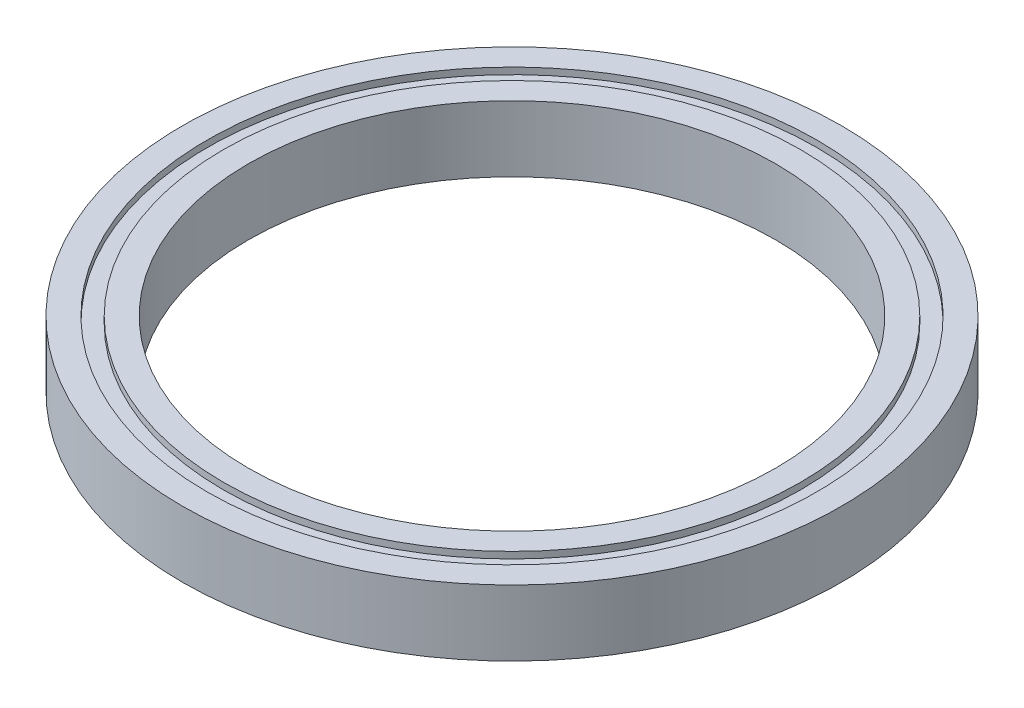
from build123d import *

# Parameters (mm, degrees)
SKETCH1_R           = 50
SKETCH1_R_2         = 40
BOSS_EXTRUDE1_DEPTH = 10
SKETCH2_R           = 46.25
SKETCH2_R_2         = 43.75
CUT_EXTRUDE1_DEPTH  = 1
CUT_EXTRUDE2_START  = -1
SKETCH3_R           = 46.25
SKETCH3_R_2         = 43.75
CUT_EXTRUDE2_DEPTH  = 1


with BuildPart() as part:
    # Sketch1 → Boss-Extrude1 (new body)
    with BuildSketch(Plane(origin=(0, 0, 0), x_dir=(1, 0, 0), z_dir=(0, 1, 0))):
        with Locations(Location((0, 0, 0), (0, 0, 270))):
            Circle(SKETCH1_R)
        with Locations(Location((0, 0, 0), (0, 0, 270))):
            Circle(SKETCH1_R_2, mode=Mode.SUBTRACT)
    extrude(amount=BOSS_EXTRUDE1_DEPTH)

    # Sketch2 → Cut-Extrude1 (cut)
    with BuildSketch(Plane(origin=(0, 10, 0), x_dir=(1, 0, 0), z_dir=(0, 1, 0))):
        with Locations(Location((0, 0, 0), (0, 0, 270))):
            Circle(SKETCH2_R)
        with Locations(Location((0, 0, 0), (0, 0, 270))):
            Circle(SKETCH2_R_2, mode=Mode.SUBTRACT)
    extrude(amount=-CUT_EXTRUDE1_DEPTH, mode=Mode.SUBTRACT)

    # Sketch3 → Cut-Extrude2 (cut)
    with BuildSketch(Plane.XZ.offset(CUT_EXTRUDE2_START)):
        with Locations(Location((0, 0, 0), (0, 0, 90))):
            Circle(SKETCH3_R)
        with Locations(Location((0, 0, 0), (0, 0, 90))):
            Circle(SKETCH3_R_2, mode=Mode.SUBTRACT)
    extrude(amount=CUT_EXTRUDE2_DEPTH, mode=Mode.SUBTRACT)


solid = part.part
